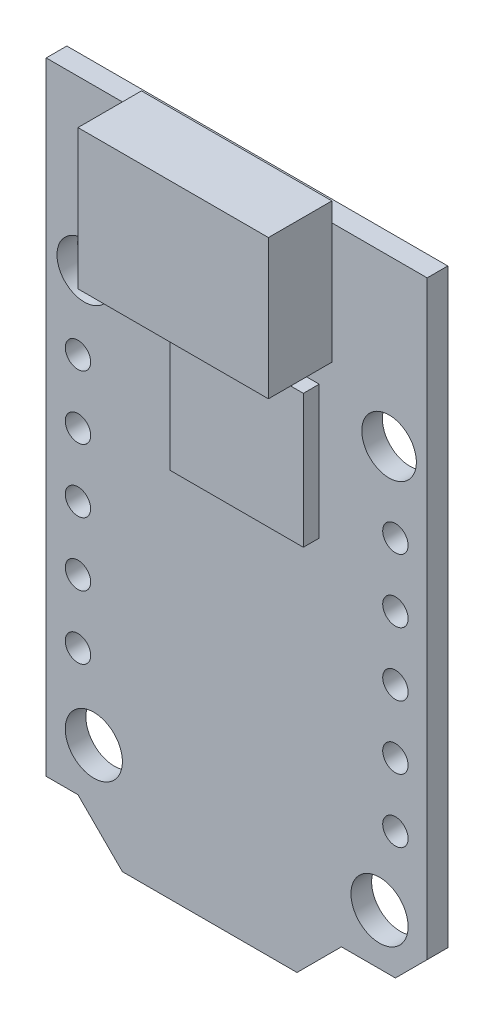
from build123d import *

# Parameters (mm, degrees)
SKETCH1_R           = 1.143
SKETCH1_R_2         = 0.508
SKETCH1_R_3         = 1.0922
BOSS_EXTRUDE1_DEPTH = 0.8255
SKETCH2_W           = 7.62
SKETCH2_H           = 5.588
BOSS_EXTRUDE2_DEPTH = 2.54
SKETCH3_W           = 5.334
SKETCH3_H           = 5.334
BOSS_EXTRUDE3_DEPTH = 0.635


with BuildPart() as part:
    # Sketch1 → Boss-Extrude1 (new body)
    with BuildSketch(Plane.XY):
        Polygon((0, 26.67), (15.24, 26.67), (15.24, 3.048), (13.97, 1.778), (11.811, 1.778), (10.033, 0), (3.048, 0), (1.27, 1.778), (0, 1.778), align=None)
        with Locations(Location((1.905, 3.81, 0), (0, 0, 180))):
            Circle(SKETCH1_R, mode=Mode.SUBTRACT)
        with Locations(Location((13.335, 3.81, 0), (0, 0, 180))):
            Circle(SKETCH1_R, mode=Mode.SUBTRACT)
        with Locations((1.27, 6.858)):
            Circle(SKETCH1_R_2, mode=Mode.SUBTRACT)
        with Locations((1.27, 9.398)):
            Circle(SKETCH1_R_2, mode=Mode.SUBTRACT)
        with Locations((1.27, 11.938)):
            Circle(SKETCH1_R_2, mode=Mode.SUBTRACT)
        with Locations((1.27, 14.478)):
            Circle(SKETCH1_R_2, mode=Mode.SUBTRACT)
        with Locations((1.27, 17.018)):
            Circle(SKETCH1_R_2, mode=Mode.SUBTRACT)
        with Locations((13.97, 17.018)):
            Circle(SKETCH1_R_2, mode=Mode.SUBTRACT)
        with Locations((13.97, 14.478)):
            Circle(SKETCH1_R_2, mode=Mode.SUBTRACT)
        with Locations((13.97, 11.938)):
            Circle(SKETCH1_R_2, mode=Mode.SUBTRACT)
        with Locations((13.97, 9.398)):
            Circle(SKETCH1_R_2, mode=Mode.SUBTRACT)
        with Locations((13.97, 6.858)):
            Circle(SKETCH1_R_2, mode=Mode.SUBTRACT)
        with Locations(Location((1.524, 20.066, 0), (0, 0, 180))):
            Circle(SKETCH1_R_3, mode=Mode.SUBTRACT)
        with Locations(Location((13.716, 20.066, 0), (0, 0, 180))):
            Circle(SKETCH1_R_3, mode=Mode.SUBTRACT)
    extrude(amount=BOSS_EXTRUDE1_DEPTH)

    # Sketch2 → Boss-Extrude2 (add)
    with BuildSketch(Plane.XY.offset(0.8255)):
        with Locations((7.62, 24.638)):
            Rectangle(SKETCH2_W, SKETCH2_H)
    extrude(amount=BOSS_EXTRUDE2_DEPTH)

    # Sketch3 → Boss-Extrude3 (add)
    with BuildSketch(Plane.XY.offset(0.8255)):
        with Locations((8.255, 18.161)):
            Rectangle(SKETCH3_W, SKETCH3_H)
    extrude(amount=BOSS_EXTRUDE3_DEPTH)


solid = part.part
